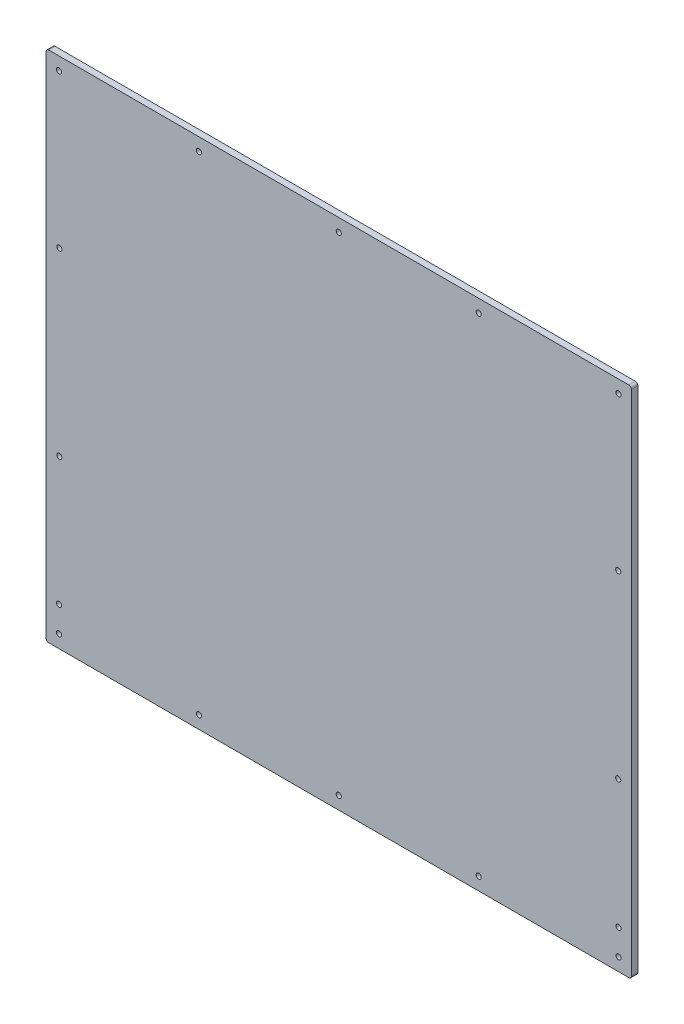
from build123d import *

# Parameters (mm, degrees)
ESQUISSE1_R        = 4
BOSS_EXTRU_1_DEPTH = 10


with BuildPart() as part:
    # Esquisse1 → Boss.-Extru.1 (new body)
    with BuildSketch(Plane.XY):
        with BuildLine():
            Line((-452, -400), (452, -400))
            ThreePointArc((452, -400), (454.828427125, -398.828427125), (456, -396))
            Line((456, -396), (456, 396))
            ThreePointArc((456, 396), (454.828427125, 398.828427125), (452, 400))
            Line((452, 400), (-452, 400))
            ThreePointArc((-452, 400), (-454.828427125, 398.828427125), (-456, 396))
            Line((-456, 396), (-456, -396))
            ThreePointArc((-456, -396), (-454.828427125, -398.828427125), (-452, -400))
        make_face()
        with Locations((436, 380)):
            Circle(ESQUISSE1_R, mode=Mode.SUBTRACT)
        with Locations((435.5, -140)):
            Circle(ESQUISSE1_R, mode=Mode.SUBTRACT)
        with Locations((435.5, 141)):
            Circle(ESQUISSE1_R, mode=Mode.SUBTRACT)
        with Locations(Location((-435.5, -140, 0), (0, 0, 180))):
            Circle(ESQUISSE1_R, mode=Mode.SUBTRACT)
        with Locations(Location((-436, 380, 0), (0, 0, 180))):
            Circle(ESQUISSE1_R, mode=Mode.SUBTRACT)
        with Locations(Location((-435.5, 141, 0), (0, 0, 180))):
            Circle(ESQUISSE1_R, mode=Mode.SUBTRACT)
        with Locations(Location((436, -380, 0), (0, 0, 180))):
            Circle(ESQUISSE1_R, mode=Mode.SUBTRACT)
        with Locations(Location((436, -340, 0), (0, 0, 180))):
            Circle(ESQUISSE1_R, mode=Mode.SUBTRACT)
        with Locations((-436, -340)):
            Circle(ESQUISSE1_R, mode=Mode.SUBTRACT)
        with Locations((-436, -380)):
            Circle(ESQUISSE1_R, mode=Mode.SUBTRACT)
        with Locations(Location((218, -380, 0), (0, 0, 180))):
            Circle(ESQUISSE1_R, mode=Mode.SUBTRACT)
        with Locations(Location((0, -380, 0), (0, 0, 180))):
            Circle(ESQUISSE1_R, mode=Mode.SUBTRACT)
        with Locations(Location((-218, -380, 0), (0, 0, 180))):
            Circle(ESQUISSE1_R, mode=Mode.SUBTRACT)
        with Locations((-218, 380)):
            Circle(ESQUISSE1_R, mode=Mode.SUBTRACT)
        with Locations((0, 380)):
            Circle(ESQUISSE1_R, mode=Mode.SUBTRACT)
        with Locations((218, 380)):
            Circle(ESQUISSE1_R, mode=Mode.SUBTRACT)
    extrude(amount=BOSS_EXTRU_1_DEPTH)


solid = part.part
